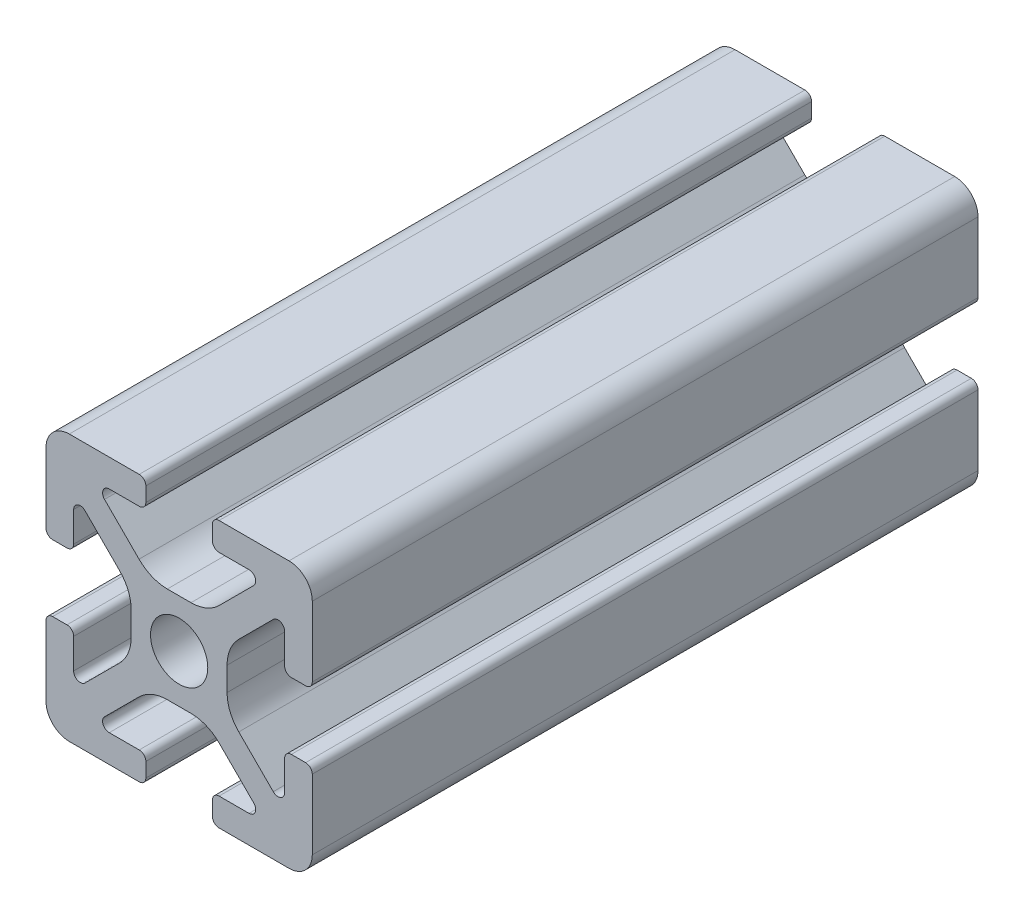
from build123d import *

# Parameters (mm, degrees)
BOSS_EXTRUDE1_DEPTH = 25


with BuildPart() as part:
    # Sketch4 → Boss-Extrude1 (new, symmetric)
    with BuildSketch(Plane.XY):
        with BuildLine():
            Line((3, -10), (8.25, -10))
            ThreePointArc((8.25, -10), (9.487436867, -9.487436867), (10, -8.25))
            Line((10, -8.25), (10, -3))
            ThreePointArc((10, -3), (9.853553391, -2.646446609), (9.5, -2.5))
            Line((9.5, -2.5), (8.424621202, -2.5))
            ThreePointArc((8.424621202, -2.5), (8.071067812, -2.646446609), (7.924621202, -3))
            Line((7.924621202, -3), (7.924621202, -5.25))
            ThreePointArc((7.924621202, -5.25), (7.615962919, -5.711939766), (7.071067812, -5.603553391))
            Line((7.071067812, -5.603553391), (4.478679656, -3.011165235))
            ThreePointArc((4.478679656, -3.011165235), (3.828361402, -2.037895189), (3.6, -0.889844892))
            Line((3.6, -0.889844892), (3.6, 0))
            Line((3.6, 0), (2.15, 0))
            ThreePointArc((2.15, 0), (1.52027958, -1.52027958), (0, -2.15))
            Line((0, -2.15), (0, -3.6))
            Line((0, -3.6), (0.889844892, -3.6))
            ThreePointArc((0.889844892, -3.6), (2.037895189, -3.828361402), (3.011165235, -4.478679656))
            Line((3.011165235, -4.478679656), (5.603553391, -7.071067812))
            ThreePointArc((5.603553391, -7.071067812), (5.711939766, -7.615962919), (5.25, -7.924621202))
            Line((5.25, -7.924621202), (3, -7.924621202))
            ThreePointArc((3, -7.924621202), (2.646446609, -8.071067812), (2.5, -8.424621202))
            Line((2.5, -8.424621202), (2.5, -9.5))
            ThreePointArc((2.5, -9.5), (2.646446609, -9.853553391), (3, -10))
        make_face()
    extrude(amount=BOSS_EXTRUDE1_DEPTH, both=True)

    # Mirror1: part across plane


with BuildPart() as part_1:
    add(part.part)
    add(part.part.mirror(Plane(origin=(0, 0, 0), x_dir=(0, 0, 1), z_dir=(1, 0, 0))))

    # Mirror2: part across plane


with BuildPart() as part_2:
    add(part_1.part)
    add(part_1.part.mirror(Plane.ZX))


solid = part_2.part
